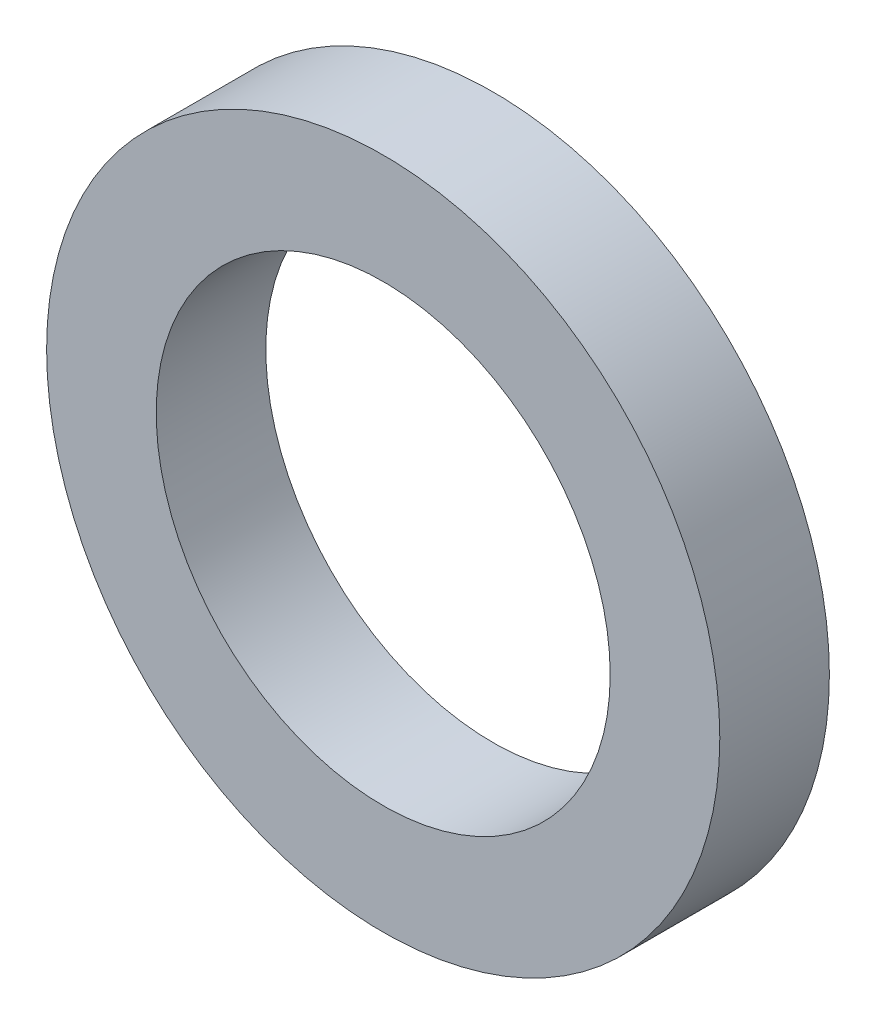
from build123d import *

# Parameters (mm, degrees)
SKETCH1_R           = 21.5
SKETCH1_R_2         = 14.5
BOSS_EXTRUDE1_DEPTH = 7


with BuildPart() as part:
    # Sketch1 → Boss-Extrude1 (new body)
    with BuildSketch(Plane.XY):
        Circle(SKETCH1_R)
        Circle(SKETCH1_R_2, mode=Mode.SUBTRACT)
    extrude(amount=BOSS_EXTRUDE1_DEPTH)


solid = part.part
